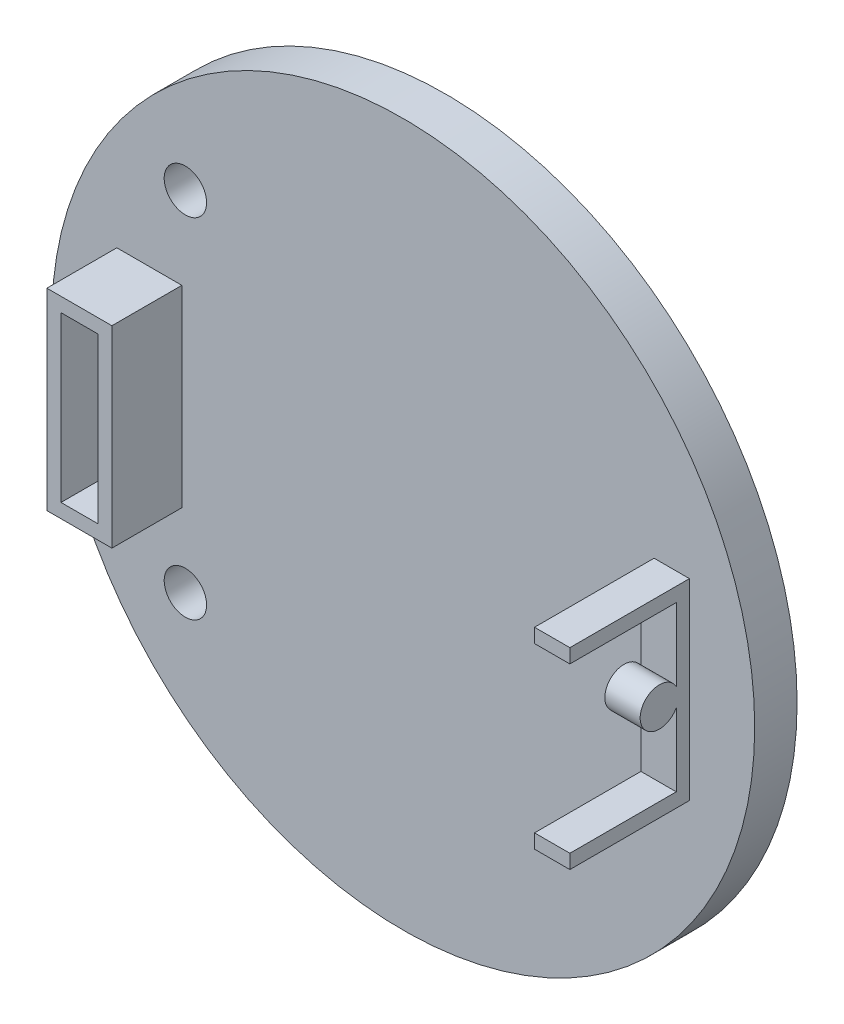
from build123d import *

# Parameters (mm, degrees)
SKETCH1_R           = 24.875
BOSS_EXTRUDE2_DEPTH = 3
SKETCH1_4_W         = 2.5
SKETCH1_4_H         = 13.6
BOSS_EXTRUDE3_DEPTH = 8.46
CUT_EXTRUDE1_DEPTH  = 2.5
SKETCH5_W           = 4.6
SKETCH5_H           = 13.63
BOSS_EXTRUDE4_DEPTH = 4.95
SKETCH9_W           = 2.6
SKETCH9_H           = 11.63
CUT_EXTRUDE2_DEPTH  = 7.95
SKETCH10_R          = 1.5
CUT_EXTRUDE3_DEPTH  = 4.95


with BuildPart() as part:
    # Sketch1 → Boss-Extrude2 (new body)
    with BuildSketch(Plane.XY):
        Circle(SKETCH1_R)
    extrude(amount=-BOSS_EXTRUDE2_DEPTH)

    # Sketch1<4> → Boss-Extrude3 (add)
    with BuildSketch(Plane.XY):
        with Locations((19.005, 0)):
            Rectangle(SKETCH1_4_W, SKETCH1_4_H)
    extrude(amount=BOSS_EXTRUDE3_DEPTH)

    # Sketch4 → Cut-Extrude1 (cut)
    with BuildSketch(Plane(origin=(20.255, 0, 0), x_dir=(0, 0, -1), z_dir=(1, 0, 0))):
        with BuildLine():
            ThreePointArc((-0.931303911, -0.65), (-3.48591682, 0), (-0.931303911, 0.65))
            Line((-0.931303911, 0.65), (-0.931303911, 5.8))
            Line((-0.931303911, 5.8), (-8.46, 5.8))
            Line((-8.46, 5.8), (-8.46, -5.8))
            Line((-8.46, -5.8), (-0.931303911, -5.8))
            Line((-0.931303911, -5.8), (-0.931303911, -0.65))
        make_face()
    extrude(amount=-CUT_EXTRUDE1_DEPTH, mode=Mode.SUBTRACT)

    # Sketch5 → Boss-Extrude4 (add)
    with BuildSketch(Plane.XY):
        with Locations((-17.96, 0)):
            Rectangle(SKETCH5_W, SKETCH5_H)
    extrude(amount=BOSS_EXTRUDE4_DEPTH)

    # Sketch9 → Cut-Extrude2 (cut)
    with BuildSketch(Plane.XY.offset(4.95)):
        with Locations((-17.96, 0)):
            Rectangle(SKETCH9_W, SKETCH9_H)
    extrude(amount=-CUT_EXTRUDE2_DEPTH, mode=Mode.SUBTRACT)

    # Sketch10 → Cut-Extrude3 (cut)
    with BuildSketch(Plane.XY):
        with Locations((-15.409206931, 12.75144494)):
            Circle(SKETCH10_R)
        with Locations((-15.409206931, -11.899319199)):
            Circle(SKETCH10_R)
    extrude(amount=-CUT_EXTRUDE3_DEPTH, mode=Mode.SUBTRACT)


solid = part.part
